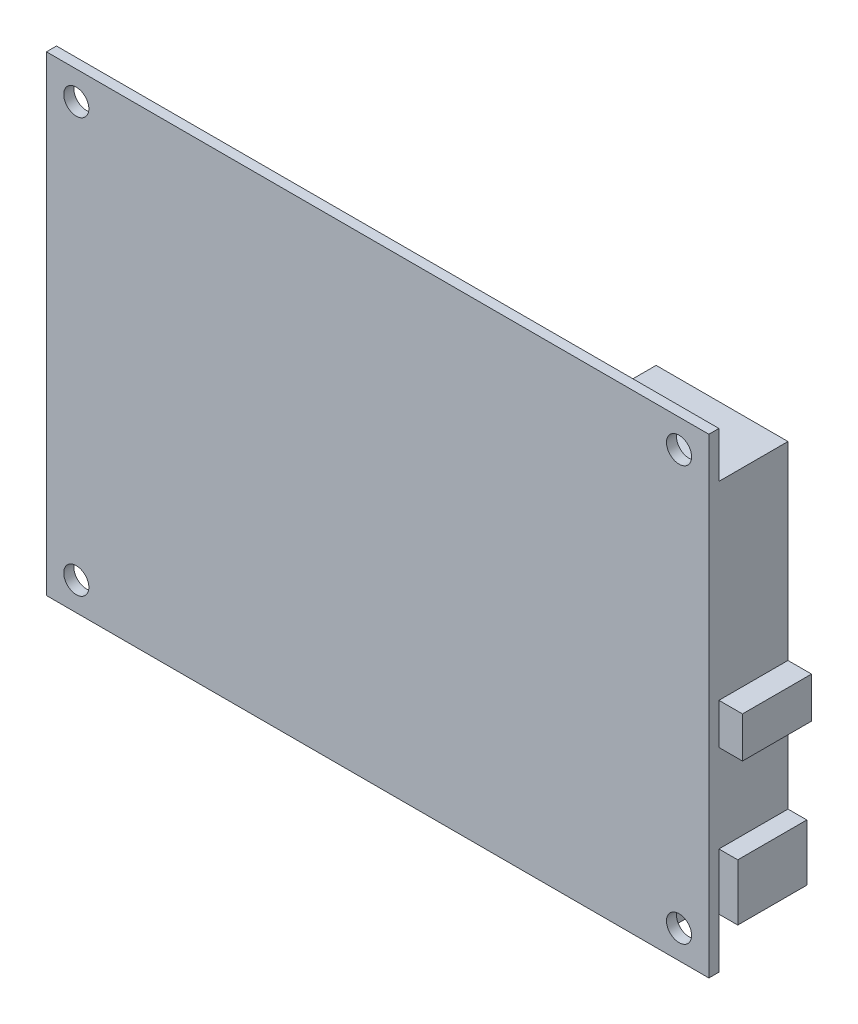
from build123d import *

# Parameters (mm, degrees)
ESQUISSE1_W        = 105.5
ESQUISSE1_H        = 75
ESQUISSE1_R        = 2
BOSS_EXTRU_1_DEPTH = 1.6
BOSS_EXTRU_2_DEPTH = 11
ESQUISSE6_W        = 13.2
ESQUISSE6_H        = 8
BOSS_EXTRU_3_DEPTH = 16
ESQUISSE7_W        = 71
ESQUISSE7_H        = 3.85
BOSS_EXTRU_4_DEPTH = 6.15
ESQUISSE8_W        = 48
ESQUISSE8_H        = 2.5
ESQUISSE8_W_2      = 39
ESQUISSE8_H_2      = 3.38327079
BOSS_EXTRU_5_DEPTH = 8.8
ESQUISSE9_W        = 5.75
ESQUISSE9_H        = 7.75
BOSS_EXTRU_6_DEPTH = 3


with BuildPart() as part:
    # Esquisse1 → Boss.-Extru.1 (new body)
    with BuildSketch(Plane.XY):
        Rectangle(ESQUISSE1_W, ESQUISSE1_H)
        with Locations((-48, 33)):
            Circle(ESQUISSE1_R, mode=Mode.SUBTRACT)
        with Locations((48, 33)):
            Circle(ESQUISSE1_R, mode=Mode.SUBTRACT)
        with Locations((-48, -33)):
            Circle(ESQUISSE1_R, mode=Mode.SUBTRACT)
        with Locations((48, -33)):
            Circle(ESQUISSE1_R, mode=Mode.SUBTRACT)
    extrude(amount=BOSS_EXTRU_1_DEPTH)

    # Esquisse5 → Boss.-Extru.2 (add)
    with BuildSketch(Plane(origin=(0, 0, 0), x_dir=(-1, 0, 0), z_dir=(0, 0, -1))):
        Polygon((-52.75, 30.2), (-31.75, 30.2), (-31.75, -29.5), (-55.75, -29.5), (-55.75, -20.5), (-52.75, -20.5), (-52.75, -6.5), (-56.5, -6.5), (-56.5, 0), (-52.75, 0), align=None)
    extrude(amount=BOSS_EXTRU_2_DEPTH)

    # Esquisse6 → Boss.-Extru.3 (add)
    with BuildSketch(Plane(origin=(0, 0, 0), x_dir=(-1, 0, 0), z_dir=(0, 0, -1))):
        with Locations((-36.15, -33.5)):
            Rectangle(ESQUISSE6_W, ESQUISSE6_H)
    extrude(amount=BOSS_EXTRU_3_DEPTH)

    # Esquisse7 → Boss.-Extru.4 (add)
    with BuildSketch(Plane(origin=(0, 0, 0), x_dir=(-1, 0, 0), z_dir=(0, 0, -1))):
        with Locations((8.55, -35.575)):
            Rectangle(ESQUISSE7_W, ESQUISSE7_H)
    extrude(amount=BOSS_EXTRU_4_DEPTH)

    # Esquisse8 → Boss.-Extru.5 (add)
    with BuildSketch(Plane(origin=(0, 0, 0), x_dir=(-1, 0, 0), z_dir=(0, 0, -1))):
        with Locations((11.55, 22.42)):
            Rectangle(ESQUISSE8_W, ESQUISSE8_H)
        with Locations((16.05, -26.308364605)):
            Rectangle(ESQUISSE8_W_2, ESQUISSE8_H_2)
    extrude(amount=BOSS_EXTRU_5_DEPTH)

    # Esquisse9 → Boss.-Extru.6 (add)
    with BuildSketch(Plane(origin=(0, 0, 0), x_dir=(-1, 0, 0), z_dir=(0, 0, -1))):
        with Locations((50.875, -1.625)):
            Rectangle(ESQUISSE9_W, ESQUISSE9_H)
    extrude(amount=BOSS_EXTRU_6_DEPTH)


solid = part.part
